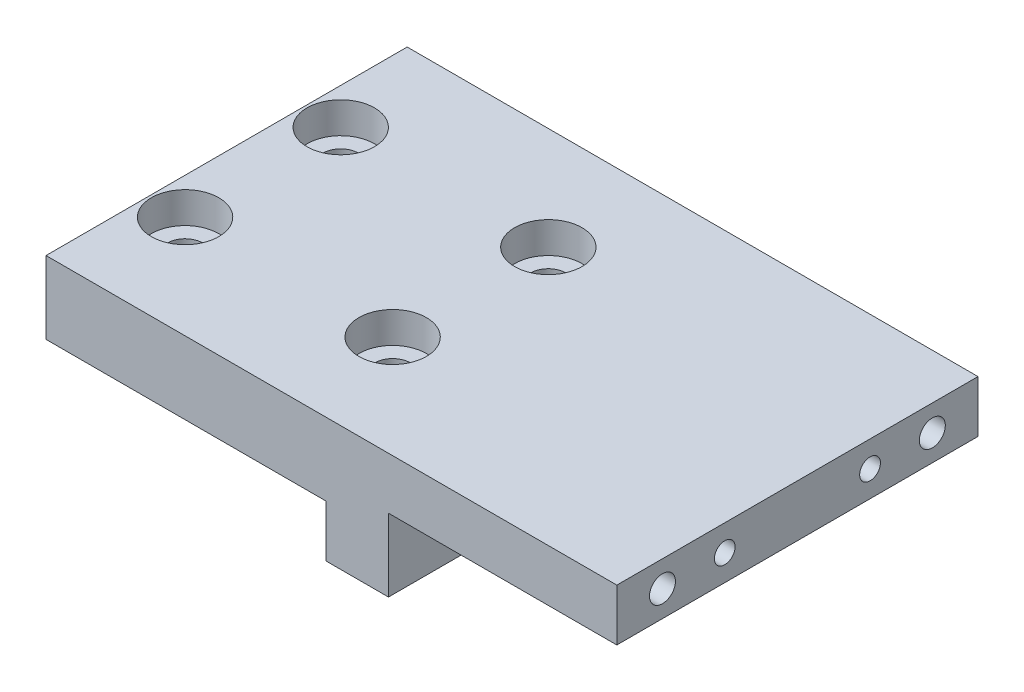
from build123d import *

# Parameters (mm, degrees)
BOSS_EXTRUDE1_DEPTH = 34.8
CUT_EXTRUDE1_REACH  = 68.182
SKETCH2_R           = 1.7
SKETCH3_R           = 0.8
CUT_EXTRUDE2_DEPTH  = 6
SKETCH4_R           = 1.25
CUT_EXTRUDE3_DEPTH  = 10
SKETCH5_R           = 1
CUT_EXTRUDE4_DEPTH  = 4
SKETCH6_R           = 3.25
CUT_EXTRUDE5_DEPTH  = 3


with BuildPart() as part:
    # Sketch1 → Boss-Extrude1 (new body)
    with BuildSketch(Plane.XY):
        Polygon((0, 0), (27, 0), (27, -5), (33, -5), (33, 2), (55, 2), (55, 7), (0, 7), align=None)
    extrude(amount=-BOSS_EXTRUDE1_DEPTH)

    # Sketch2 → Cut-Extrude1 (cut, up to next)
    with BuildSketch(Plane(origin=(0, 7, 0), x_dir=(1, 0, 0), z_dir=(0, 1, 0)), mode=Mode.PRIVATE) as cut_extrude1_sk1:
        with Locations(Location((3.5, 24.9, 0), (0, 0, 180))):
            Circle(SKETCH2_R)
    cut_extrude1_tool1 = extrude(cut_extrude1_sk1.sketch, amount=-CUT_EXTRUDE1_REACH, mode=Mode.PRIVATE) & part.part
    # Sketch2 → Cut-Extrude1 (cut, up to next)
    with BuildSketch(Plane(origin=(0, 7, 0), x_dir=(1, 0, 0), z_dir=(0, 1, 0)), mode=Mode.PRIVATE) as cut_extrude1_sk2:
        with Locations(Location((23.5, 24.9, 0), (0, 0, 180))):
            Circle(SKETCH2_R)
    cut_extrude1_tool2 = extrude(cut_extrude1_sk2.sketch, amount=-CUT_EXTRUDE1_REACH, mode=Mode.PRIVATE) & part.part
    # Sketch2 → Cut-Extrude1 (cut, up to next)
    with BuildSketch(Plane(origin=(0, 7, 0), x_dir=(1, 0, 0), z_dir=(0, 1, 0)), mode=Mode.PRIVATE) as cut_extrude1_sk3:
        with Locations(Location((23.5, 9.9, 0), (0, 0, 180))):
            Circle(SKETCH2_R)
    cut_extrude1_tool3 = extrude(cut_extrude1_sk3.sketch, amount=-CUT_EXTRUDE1_REACH, mode=Mode.PRIVATE) & part.part
    # Sketch2 → Cut-Extrude1 (cut, up to next)
    with BuildSketch(Plane(origin=(0, 7, 0), x_dir=(1, 0, 0), z_dir=(0, 1, 0)), mode=Mode.PRIVATE) as cut_extrude1_sk4:
        with Locations(Location((3.5, 9.9, 0), (0, 0, 180))):
            Circle(SKETCH2_R)
    cut_extrude1_tool4 = extrude(cut_extrude1_sk4.sketch, amount=-CUT_EXTRUDE1_REACH, mode=Mode.PRIVATE) & part.part
    add(cut_extrude1_tool1.solids().sort_by_distance((3.5, 7, -24.9))[0], mode=Mode.SUBTRACT)
    add(cut_extrude1_tool2.solids().sort_by_distance((23.5, 7, -24.9))[0], mode=Mode.SUBTRACT)
    add(cut_extrude1_tool3.solids().sort_by_distance((23.5, 7, -9.9))[0], mode=Mode.SUBTRACT)
    add(cut_extrude1_tool4.solids().sort_by_distance((3.5, 7, -9.9))[0], mode=Mode.SUBTRACT)

    # Sketch3 → Cut-Extrude2 (cut)
    with BuildSketch(Plane(origin=(33, 0, 0), x_dir=(0, 0, -1), z_dir=(1, 0, 0))):
        with Locations((8.9, -1)):
            Circle(SKETCH3_R)
        with Locations(Location((25.9, -1, 0), (0, 0, 180))):
            Circle(SKETCH3_R)
    extrude(amount=-CUT_EXTRUDE2_DEPTH, mode=Mode.SUBTRACT)

    # Sketch4 → Cut-Extrude3 (cut)
    with BuildSketch(Plane(origin=(55, 0, 0), x_dir=(0, 0, -1), z_dir=(1, 0, 0))):
        with Locations((4.4, 4.5)):
            Circle(SKETCH4_R)
        with Locations(Location((30.4, 4.5, 0), (0, 0, 180))):
            Circle(SKETCH4_R)
    extrude(amount=-CUT_EXTRUDE3_DEPTH, mode=Mode.SUBTRACT)

    # Sketch5 → Cut-Extrude4 (cut)
    with BuildSketch(Plane(origin=(55, 0, 0), x_dir=(0, 0, -1), z_dir=(1, 0, 0))):
        with Locations((10.4, 4.5)):
            Circle(SKETCH5_R)
        with Locations(Location((24.4, 4.5, 0), (0, 0, 180))):
            Circle(SKETCH5_R)
    extrude(amount=-CUT_EXTRUDE4_DEPTH, mode=Mode.SUBTRACT)

    # Sketch6 → Cut-Extrude5 (cut)
    with BuildSketch(Plane(origin=(0, 7, 0), x_dir=(1, 0, 0), z_dir=(0, 1, 0))):
        with Locations(Location((3.5, 24.9, 0), (0, 0, 180))):
            Circle(SKETCH6_R)
        with Locations(Location((23.5, 24.9, 0), (0, 0, 180))):
            Circle(SKETCH6_R)
        with Locations(Location((23.5, 9.9, 0), (0, 0, 180))):
            Circle(SKETCH6_R)
        with Locations(Location((3.5, 9.9, 0), (0, 0, 180))):
            Circle(SKETCH6_R)
    extrude(amount=-CUT_EXTRUDE5_DEPTH, mode=Mode.SUBTRACT)


solid = part.part
